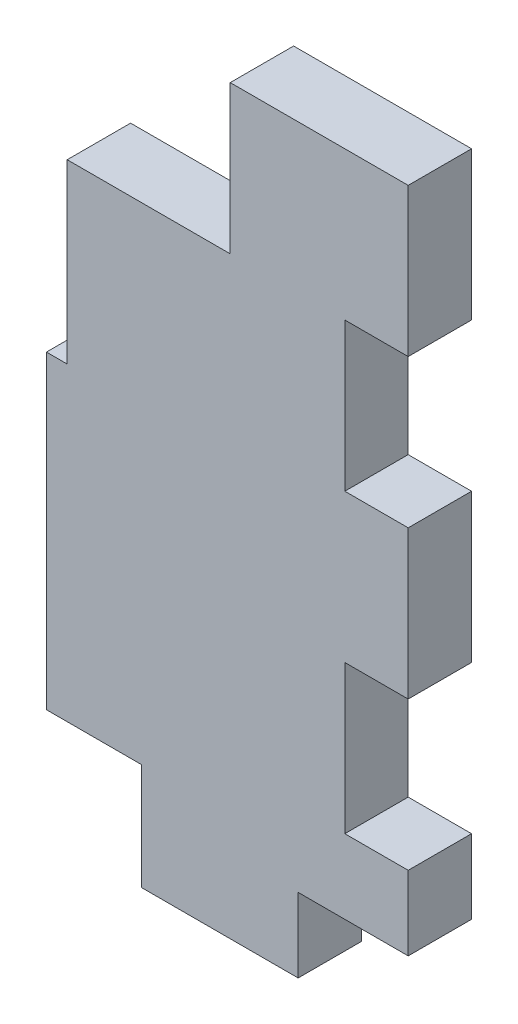
from build123d import *

# Parameters (mm, degrees)
BOSS_EXTRUDE1_DEPTH = 4.5593


with BuildPart() as part:
    # Sketch1 → Boss-Extrude1 (new body)
    with BuildSketch(Plane.XY):
        Polygon((24.0884075, -21.336), (32.004, -21.336), (32.004, -16.002), (27.4447, -16.002), (27.4447, -5.334), (32.004, -5.334), (32.004, 5.334), (27.4447, 5.334), (27.4447, 16.002), (32.004, 16.002), (32.004, 26.67), (19.2024, 26.67), (19.2024, 21.336), (19.2024, 16.002), (7.47522, 16.002), (7.47522, 12.9921), (7.47522, 3.27152), (5.980176, 3.27152), (5.980176, -19.0119), (8.2572225, -19.0119), (12.8165225, -19.0119), (12.8165225, -26.67), (24.0884075, -26.67), align=None)
    extrude(amount=BOSS_EXTRUDE1_DEPTH)


solid = part.part
